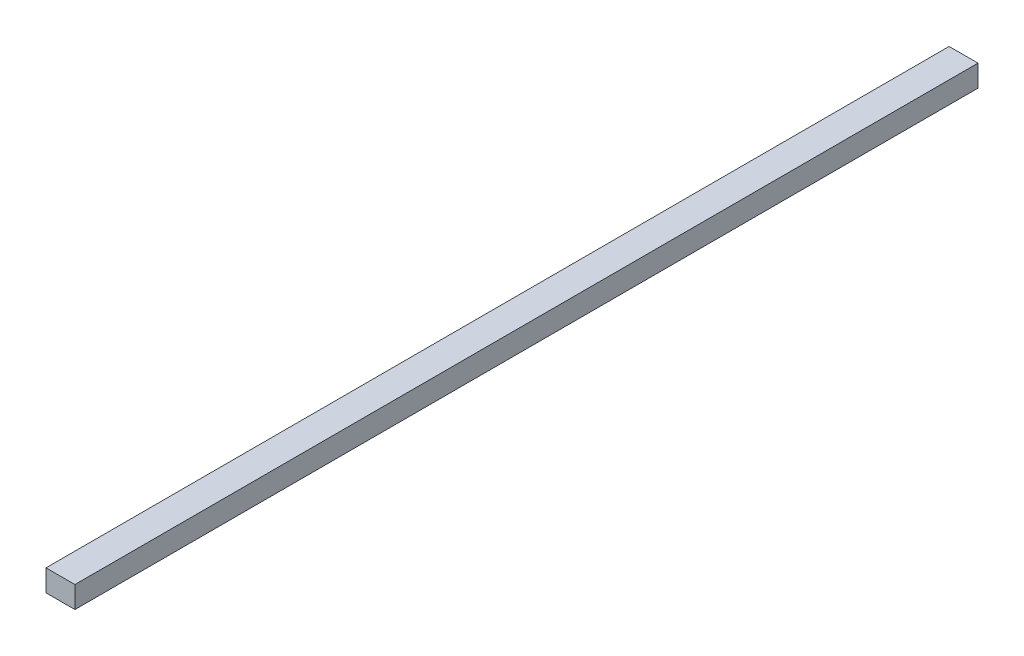
from build123d import *

# Parameters (mm, degrees)
PRESS_UC_CATAL_LAMA_2_1_START = -50
SKETCH1_W                     = 16
SKETCH1_H                     = 12
PRESS_UC_CATAL_LAMA_2_1_DEPTH = 500


with BuildPart() as part:
    # Sketch1 → PRESS_uc_catal_lama_2_1 (new body)
    with BuildSketch(Plane.XY.offset(PRESS_UC_CATAL_LAMA_2_1_START)):
        with Locations((402, 1182)):
            Rectangle(SKETCH1_W, SKETCH1_H)
    extrude(amount=-PRESS_UC_CATAL_LAMA_2_1_DEPTH)


solid = part.part
